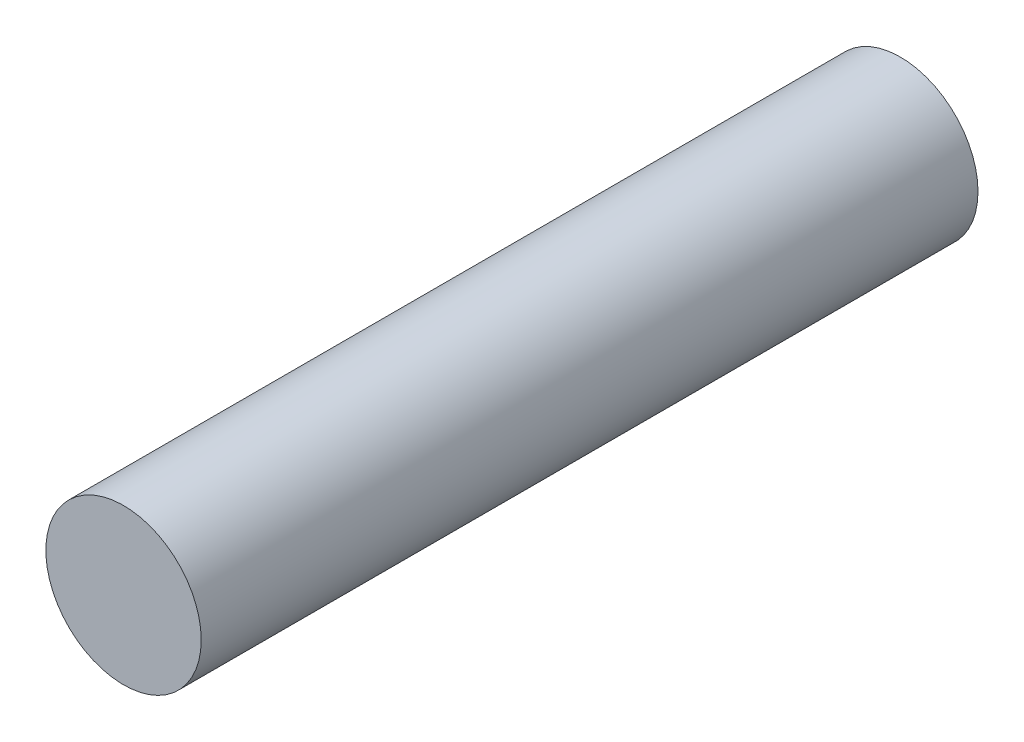
from build123d import *

# Parameters (mm, degrees)
CROQUIS1_R              = 1
SALIENTE_EXTRUIR1_DEPTH = 10


with BuildPart() as part:
    # Croquis1 → Saliente-Extruir1 (new body)
    with BuildSketch(Plane.XY):
        Circle(CROQUIS1_R)
    extrude(amount=SALIENTE_EXTRUIR1_DEPTH)


solid = part.part
